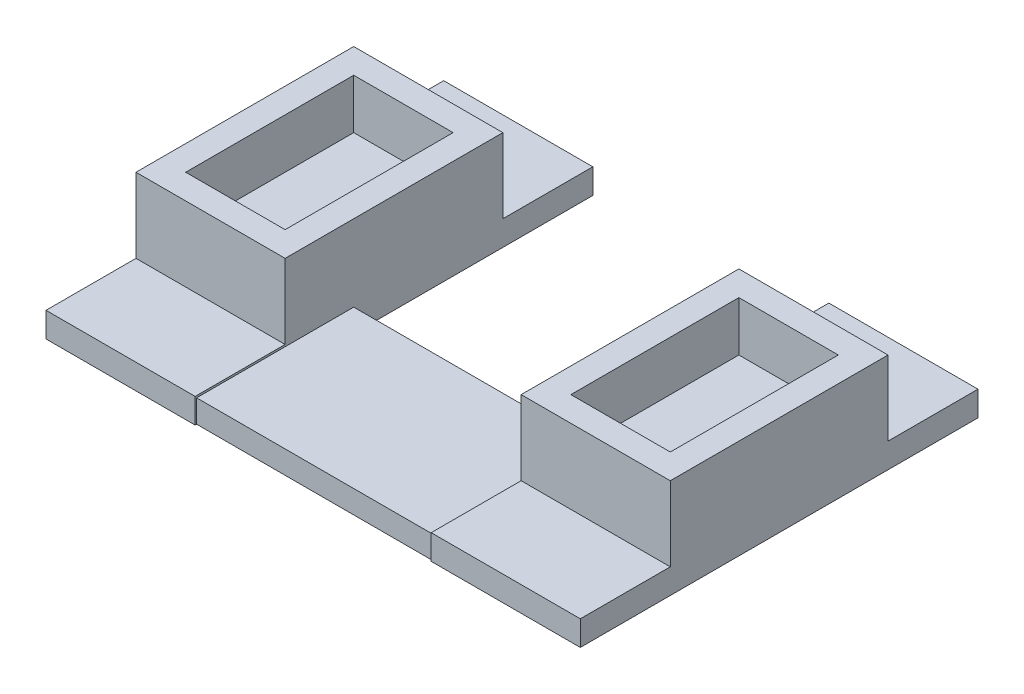
from build123d import *

# Parameters (mm, degrees)
SKETCH1_W           = 12.7
SKETCH1_H           = 21.463
BOSS_EXTRUDE1_DEPTH = 6.35
BOSS_EXTRUDE2_DEPTH = 3.175
BOSS_EXTRUDE3_DEPTH = 3.175
SKETCH4_W           = 30.1498
SKETCH4_H           = 8.763
CUT_EXTRUDE1_DEPTH  = 9.779
SKETCH6_W           = 30.1498
SKETCH6_H           = 2.921
BOSS_EXTRUDE4_DEPTH = 11.303


with BuildPart() as part:
    # Sketch1 → Boss-Extrude1 (new body)
    with BuildSketch(Plane(origin=(0, 0, 0), x_dir=(1, 0, 0), z_dir=(0, 1, 0))):
        Polygon((-34.1249, 13.9065), (-34.1249, -13.9065), (-15.0749, -13.9065), (15.0749, -13.9065), (34.1249, -13.9065), (34.1249, 13.9065), (15.0749, 13.9065), (15.0749, -5.1435), (-15.0749, -5.1435), (-15.0749, 13.9065), align=None)
        with Locations((-24.5999, 0)):
            Rectangle(SKETCH1_W, SKETCH1_H, mode=Mode.SUBTRACT)
        with Locations((24.5999, 0)):
            Rectangle(SKETCH1_W, SKETCH1_H, mode=Mode.SUBTRACT)
    extrude(amount=BOSS_EXTRUDE1_DEPTH)

    # Sketch2 → Boss-Extrude2 (add)
    with BuildSketch(Plane.XZ):
        Polygon((-15.0749, 5.1435), (-15.0749, -13.9065), (-34.1249, -13.9065), (-34.1249, 13.9065), (34.1249, 13.9065), (34.1249, -13.9065), (15.0749, -13.9065), (15.0749, 5.1435), align=None)
    extrude(amount=BOSS_EXTRUDE2_DEPTH)

    # Sketch3 → Boss-Extrude3 (add)
    with BuildSketch(Plane.XZ.offset(3.175)):
        Polygon((-34.1249, -25.4), (-15.0749, -25.4), (-15.0749, 5.1435), (15.0749, 5.1435), (15.0749, -25.4), (34.1249, -25.4), (34.1249, 25.4), (15.0749, 25.4), (15.0749, 13.9065), (-15.0749, 13.9065), (-15.0749, 25.4), (-34.1249, 25.4), align=None)
    extrude(amount=BOSS_EXTRUDE3_DEPTH)

    # Sketch4 → Cut-Extrude1 (cut)
    with BuildSketch(Plane(origin=(0, 6.35, 0), x_dir=(1, 0, 0), z_dir=(0, 1, 0))):
        with Locations((0, -9.525)):
            Rectangle(SKETCH4_W, SKETCH4_H)
    extrude(amount=-CUT_EXTRUDE1_DEPTH, mode=Mode.SUBTRACT)

    # Sketch6 → Boss-Extrude4 (add)
    with BuildSketch(Plane.XY.offset(13.9065)):
        with Locations((0, -4.8895)):
            Rectangle(SKETCH6_W, SKETCH6_H)
    extrude(amount=BOSS_EXTRUDE4_DEPTH)


solid = part.part
